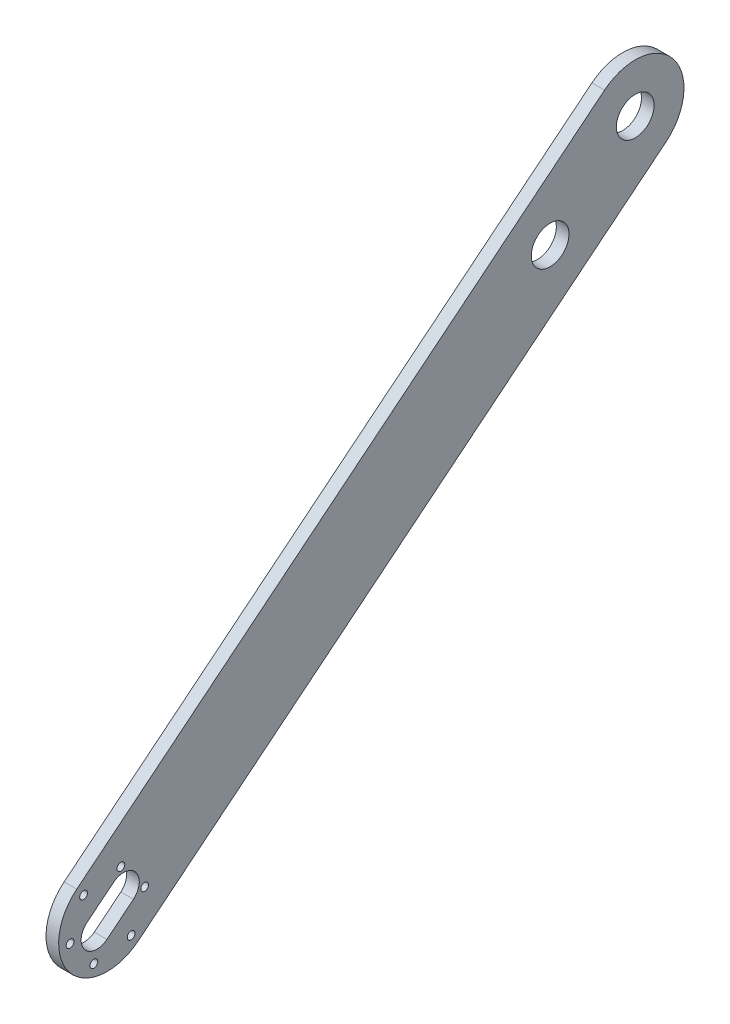
from build123d import *

# Parameters (mm, degrees)
SKETCH1_R           = 7.7375
SKETCH1_R_2         = 1.6
BOSS_EXTRUDE1_DEPTH = 5.1784


with BuildPart() as part:
    # Sketch1 → Boss-Extrude1 (new body)
    with BuildSketch(Plane(origin=(0, 0, 0), x_dir=(0, 0, -1), z_dir=(1, 0, 0))):
        with BuildLine():
            Line((-148.619647966, -94.78818035), (68.068798078, 80.959130728))
            ThreePointArc((68.068798078, 80.959130728), (96.200393571, 78.024282343), (93.265545186, 49.89268685))
            Line((93.265545186, 49.89268685), (-123.422900858, -125.854624227))
            ThreePointArc((-123.422900858, -125.854624227), (-151.554496351, -122.919775842), (-148.619647966, -94.78818035))
        make_face()
        with Locations((80.667171632, 65.425908789)):
            Circle(SKETCH1_R, mode=Mode.SUBTRACT)
        with Locations((45.71742227, 37.079568293)):
            Circle(SKETCH1_R, mode=Mode.SUBTRACT)
        with Locations((-141.564832381, -124.796172236)):
            Circle(SKETCH1_R_2, mode=Mode.SUBTRACT)
        with Locations((-151.328571886, -112.757925234)):
            Circle(SKETCH1_R_2, mode=Mode.SUBTRACT)
        with Locations((-145.785013917, -98.283155286)):
            Circle(SKETCH1_R_2, mode=Mode.SUBTRACT)
        with Locations((-130.477716443, -95.84663234)):
            Circle(SKETCH1_R_2, mode=Mode.SUBTRACT)
        with Locations((-120.713976939, -107.884879343)):
            Circle(SKETCH1_R_2, mode=Mode.SUBTRACT)
        with Locations((-126.257534908, -122.359649291)):
            Circle(SKETCH1_R_2, mode=Mode.SUBTRACT)
        with BuildLine():
            Line((-125.325183683, -110.015390658), (-136.19843904, -118.834252146))
            ThreePointArc((-136.19843904, -118.834252146), (-145.341207576, -117.880426421), (-144.387381851, -108.737657886))
            Line((-144.387381851, -108.737657886), (-133.514126493, -99.918796398))
            ThreePointArc((-133.514126493, -99.918796398), (-124.371357958, -100.872622123), (-125.325183683, -110.015390658))
        make_face(mode=Mode.SUBTRACT)
    extrude(amount=BOSS_EXTRUDE1_DEPTH)


solid = part.part
